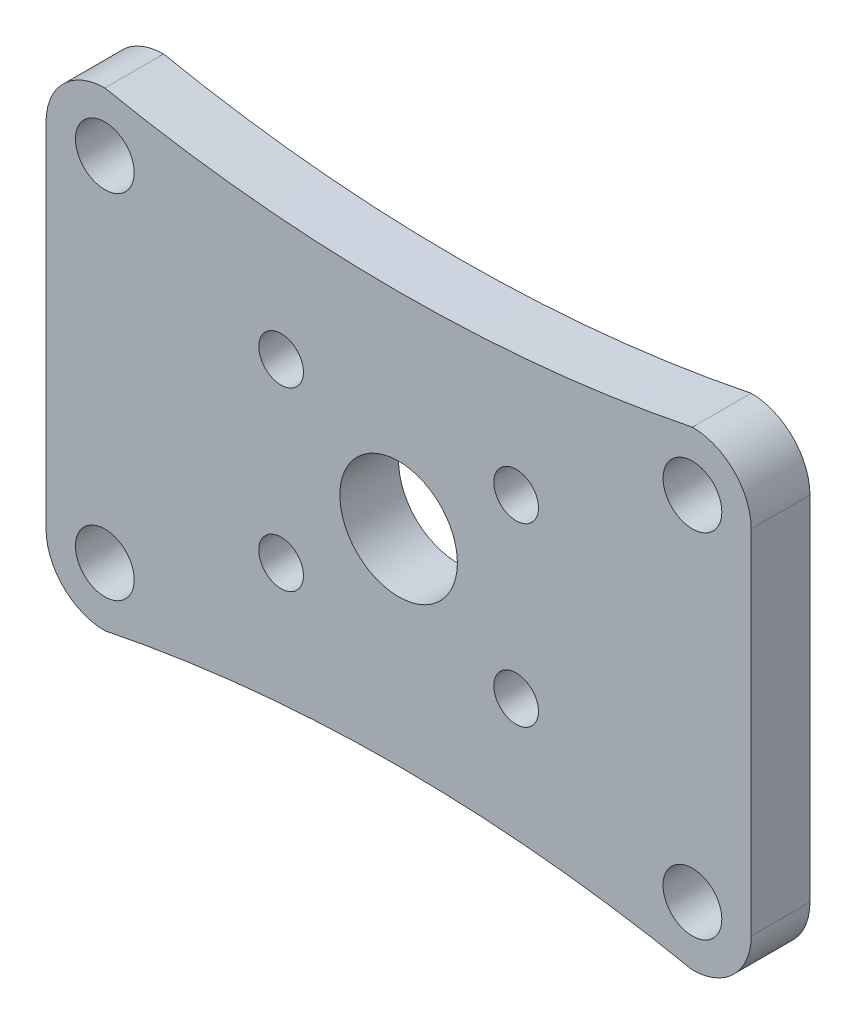
from build123d import *

# Parameters (mm, degrees)
SKETCH1_R           = 3.175
BOSS_EXTRUDE1_DEPTH = 6.35
SKETCH3_R           = 6.35
CUT_EXTRUDE1_DEPTH  = 6.35
SKETCH4_R           = 2.413
CUT_EXTRUDE2_DEPTH  = 6.35


with BuildPart() as part:
    # Sketch1 → Boss-Extrude1 (new body)
    with BuildSketch(Plane.XY):
        with BuildLine():
            Line((-388.789077681, 181.190585859), (-388.789077681, 143.090585859))
            ThreePointArc((-388.789077681, 143.090585859), (-386.929205741, 138.600457798), (-382.439077681, 136.740585859))
            ThreePointArc((-382.439077681, 136.740585859), (-350.689077681, 139.944338866), (-318.939077681, 136.740585859))
            ThreePointArc((-318.939077681, 136.740585859), (-314.44894962, 138.600457798), (-312.589077681, 143.090585859))
            Line((-312.589077681, 143.090585859), (-312.589077681, 181.190585859))
            ThreePointArc((-312.589077681, 181.190585859), (-314.44894962, 185.680713919), (-318.939077681, 187.540585859))
            ThreePointArc((-318.939077681, 187.540585859), (-350.689077681, 184.336832851), (-382.439077681, 187.540585859))
            ThreePointArc((-382.439077681, 187.540585859), (-386.929205741, 185.680713919), (-388.789077681, 181.190585859))
        make_face()
        with Locations((-382.439077681, 181.190585859)):
            Circle(SKETCH1_R, mode=Mode.SUBTRACT)
        with Locations((-318.939077681, 181.190585859)):
            Circle(SKETCH1_R, mode=Mode.SUBTRACT)
        with Locations((-382.439077681, 143.090585859)):
            Circle(SKETCH1_R, mode=Mode.SUBTRACT)
        with Locations((-318.939077681, 143.090585859)):
            Circle(SKETCH1_R, mode=Mode.SUBTRACT)
    extrude(amount=BOSS_EXTRUDE1_DEPTH)

    # Sketch3 → Cut-Extrude1 (cut)
    with BuildSketch(Plane.XY.offset(6.35)):
        with Locations((-350.689077681, 162.140585859)):
            Circle(SKETCH3_R)
    extrude(amount=-CUT_EXTRUDE1_DEPTH, mode=Mode.SUBTRACT)

    # Sketch4 → Cut-Extrude2 (cut)
    with BuildSketch(Plane.XY.offset(6.35)):
        with Locations((-337.989077681, 171.665585859)):
            Circle(SKETCH4_R)
        with Locations((-337.989077681, 152.615585859)):
            Circle(SKETCH4_R)
        with Locations((-363.389077681, 152.615585859)):
            Circle(SKETCH4_R)
        with Locations((-363.389077681, 171.665585859)):
            Circle(SKETCH4_R)
    extrude(amount=-CUT_EXTRUDE2_DEPTH, mode=Mode.SUBTRACT)


solid = part.part
